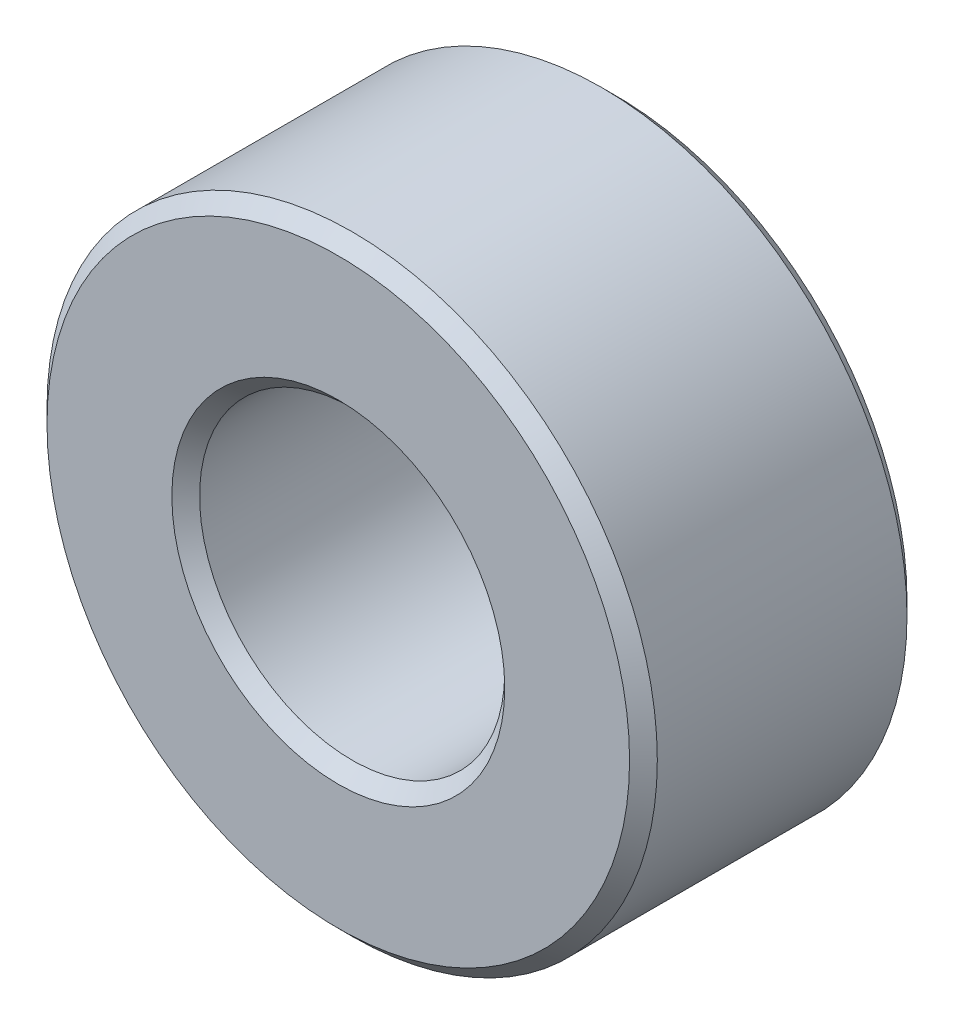
from build123d import *

# Parameters (mm, degrees)
SKICA1_R                = 11
SKICA1_R_2              = 5.5
P_IDAT_VYSUNUT_M1_DEPTH = 10
ZKOSEN_1_SIZE           = 0.5


with BuildPart() as part:
    # Skica1 → Přidat vysunutím1 (new body)
    with BuildSketch(Plane.XY):
        Circle(SKICA1_R)
        Circle(SKICA1_R_2, mode=Mode.SUBTRACT)
    extrude(amount=P_IDAT_VYSUNUT_M1_DEPTH)

    # Zkosení1
    zkosen_1_edges = [part.edges().sort_by_distance(p)[0] for p in [
        (-11, 0, 0),
        (-11, 0, 10),
        (-5.5, 0, 0),
        (-5.5, 0, 10),
    ]]
    chamfer(zkosen_1_edges, length=ZKOSEN_1_SIZE)


solid = part.part
